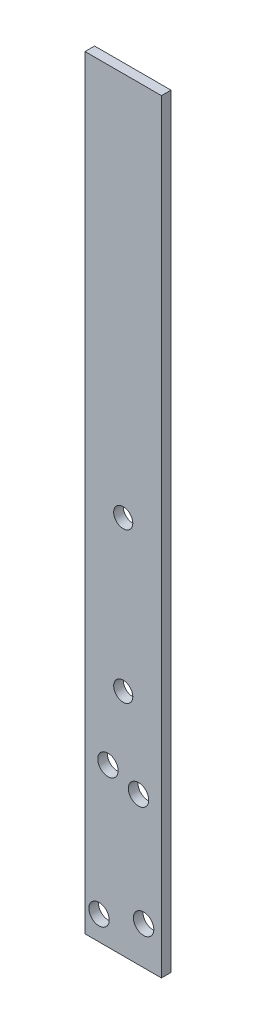
from build123d import *

# Parameters (mm, degrees)
SKETCH2_W           = 38.1
SKETCH2_H           = 381
SKETCH2_R           = 5.08
SKETCH2_R_2         = 4.7625
BOSS_EXTRUDE2_DEPTH = 4.7625


with BuildPart() as part:
    # Sketch2 → Boss-Extrude2 (new body)
    with BuildSketch(Plane.XY):
        with Locations((19.05, 190.5)):
            Rectangle(SKETCH2_W, SKETCH2_H)
        with Locations(Location((11.43, 78.69046619, 0), (0, 0, 180))):
            Circle(SKETCH2_R, mode=Mode.SUBTRACT)
        with Locations(Location((26.67, 73.61046619, 0), (0, 0, 180))):
            Circle(SKETCH2_R, mode=Mode.SUBTRACT)
        with Locations(Location((6.985, 12.01546619, 0), (0, 0, 180))):
            Circle(SKETCH2_R, mode=Mode.SUBTRACT)
        with Locations(Location((29.21, 19.00046619, 0), (0, 0, 180))):
            Circle(SKETCH2_R, mode=Mode.SUBTRACT)
        with Locations(Location((19.05, 114.3, 0), (0, 0, 180))):
            Circle(SKETCH2_R_2, mode=Mode.SUBTRACT)
        with Locations(Location((19.05, 189.23, 0), (0, 0, 180))):
            Circle(SKETCH2_R_2, mode=Mode.SUBTRACT)
    extrude(amount=BOSS_EXTRUDE2_DEPTH)


solid = part.part
